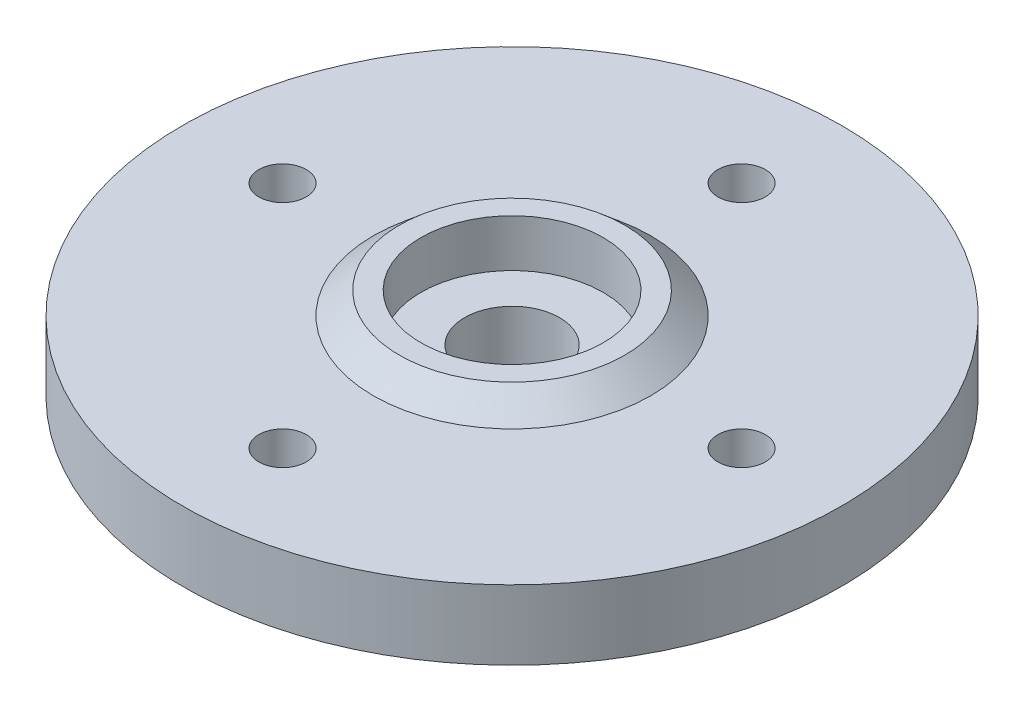
from build123d import *

# Parameters (mm, degrees)
SKETCH_2_R            = 0.75
CUT_EXTRUDE_619_DEPTH = 16.681077769


with BuildPart() as part:
    # 草图1 → 旋转1 (revolve)
    with BuildSketch(Plane.XY, mode=Mode.PRIVATE) as revolve_1_sk:
        Polygon((-2.88, 0), (-2.88, 2.9), (-1.5, 2.9), (-1.5, 4.6), (-2.88, 4.6), (-2.88, 6.1), (-3.56, 6.1), (-4.38, 5.4), (-10.41, 5.4), (-10.41, 3.2), (-4.33, 3.2), (-4.33, 0), align=None)
    revolve(revolve_1_sk.sketch.rotate(Axis((0, 0, 0), (0, 1, 0)), 270), axis=Axis((0, 0, 0), (0, 1, 0)))

    # 草图2 → Cut-Extrude 619 (cut, through all)
    with BuildSketch(Plane(origin=(0, 5.4, 0), x_dir=(1, 0, 0), z_dir=(0, 1, 0))):
        with Locations(Location((0, 7.25, 0), (0, 0, 270))):
            Circle(SKETCH_2_R)
        with Locations(Location((7.25, 0, 0), (0, 0, 270))):
            Circle(SKETCH_2_R)
        with Locations(Location((0, -7.25, 0), (0, 0, 270))):
            Circle(SKETCH_2_R)
        with Locations(Location((-7.25, 0, 0), (0, 0, 270))):
            Circle(SKETCH_2_R)
    extrude(amount=-CUT_EXTRUDE_619_DEPTH, mode=Mode.SUBTRACT)


solid = part.part
